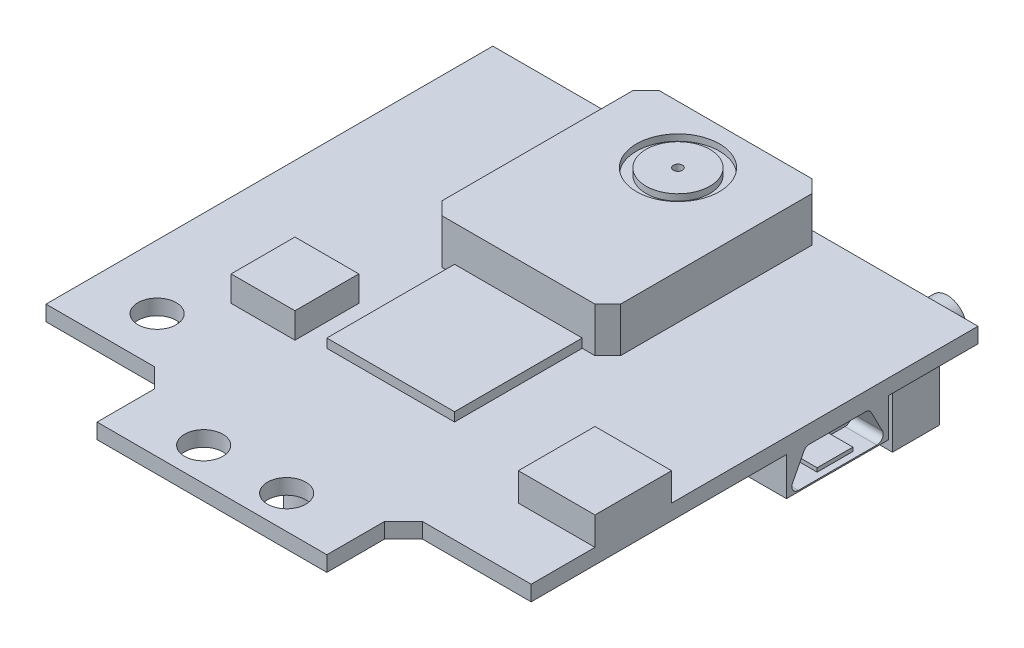
from build123d import *

# Parameters (mm, degrees)
SKETCH_1_R          = 1.5
EXTRUDE_1_DEPTH     = 1.2
EXTRUDE_2_DEPTH     = 3.5
SKETCH_3_R          = 3.25
SKETCH_3_R_2        = 2.5
CUT_EXTRUDE_1_DEPTH = 0.5
SKETCH_4_R          = 0.35
CUT_EXTRUDE_2_DEPTH = 0.7
SKETCH_5_W          = 6
SKETCH_5_H          = 6
EXTRUDE_3_DEPTH     = 2.2
SKETCH_6_W          = 10
SKETCH_6_H          = 10
EXTRUDE_4_DEPTH     = 0.7
SKETCH_7_W          = 5
SKETCH_7_H          = 5
EXTRUDE_5_DEPTH     = 2
SKETCH_8_W          = 5
SKETCH_8_H          = 8
EXTRUDE_6_DEPTH     = 3
CUT_EXTRUDE_3_DEPTH = 2.5
SKETCH_10_W         = 2.8
SKETCH_10_H         = 0.3
EXTRUDE_7_DEPTH     = 2.3
SKETCH_11_R         = 3
EXTRUDE_8_DEPTH     = 7.1
FILLET_1_R          = 0.02
SKETCH_12_W         = 7
SKETCH_12_H         = 3.7
EXTRUDE_9_DEPTH     = 7
SKETCH_13_R         = 1.5
EXTRUDE_10_DEPTH    = 4.1
SKETCH_14_W         = 8.5
SKETCH_14_H         = 20
SKETCH_14_W_2       = 7.5
SKETCH_14_H_2       = 19
EXTRUDE_11_DEPTH    = 9.5
SKETCH_15_W         = 0.5
SKETCH_15_H         = 0.5
EXTRUDE_12_DEPTH    = 8.5
SKETCH_16_W         = 0.5
SKETCH_16_H         = 0.5
EXTRUDE_13_DEPTH    = 8.5
SKETCH_17_W         = 7.5
SKETCH_17_H         = 19
EXTRUDE_14_DEPTH    = 2.5


with BuildPart() as part:
    # 草图1 → 凸台-拉伸1 (new body)
    with BuildSketch(Plane(origin=(0, 0, 0), x_dir=(1, 0, 0), z_dir=(0, 1, 0))):
        Polygon((9, -19), (10.5, -17.5), (19, -17.5), (19, 17.5), (-19, 17.5), (-19, -17.5), (-10.5, -17.5), (-9, -19), (-9, -23.5), (9, -23.5), align=None)
        with Locations((-14, -13.8)):
            Circle(SKETCH_1_R, mode=Mode.SUBTRACT)
        with Locations((-3.25, -20.9)):
            Circle(SKETCH_1_R, mode=Mode.SUBTRACT)
        with Locations((3.25, -20.9)):
            Circle(SKETCH_1_R, mode=Mode.SUBTRACT)
    extrude(amount=-EXTRUDE_1_DEPTH)

    # 草图2 → 凸台-拉伸2 (add)
    with BuildSketch(Plane(origin=(0, 0, 0), x_dir=(1, 0, 0), z_dir=(0, 1, 0))):
        Polygon((-6, 17.5), (6, 17.5), (7, 16.5), (7, 1.5), (6, 0.5), (-6, 0.5), (-7, 1.5), (-7, 16.5), align=None)
    extrude(amount=EXTRUDE_2_DEPTH)

    # 草图3 → 切除-拉伸1 (cut)
    with BuildSketch(Plane(origin=(0, 3.5, 0), x_dir=(1, 0, 0), z_dir=(0, 1, 0))):
        with Locations((0, 13)):
            Circle(SKETCH_3_R)
        with Locations((0, 13)):
            Circle(SKETCH_3_R_2, mode=Mode.SUBTRACT)
    extrude(amount=-CUT_EXTRUDE_1_DEPTH, mode=Mode.SUBTRACT)

    # 草图4 → 切除-拉伸2 (cut)
    with BuildSketch(Plane(origin=(0, 3.5, 0), x_dir=(1, 0, 0), z_dir=(0, 1, 0))):
        with Locations((0, 13)):
            Circle(SKETCH_4_R)
    extrude(amount=-CUT_EXTRUDE_2_DEPTH, mode=Mode.SUBTRACT)

    # 草图5 → 凸台-拉伸3 (add)
    with BuildSketch(Plane(origin=(0, 0, 0), x_dir=(1, 0, 0), z_dir=(0, 1, 0))):
        with Locations((16, -9.5)):
            Rectangle(SKETCH_5_W, SKETCH_5_H)
    extrude(amount=EXTRUDE_3_DEPTH)

    # 草图6 → 凸台-拉伸4 (add)
    with BuildSketch(Plane(origin=(0, 0, 0), x_dir=(1, 0, 0), z_dir=(0, 1, 0))):
        with Locations((0, -4.5)):
            Rectangle(SKETCH_6_W, SKETCH_6_H)
    extrude(amount=EXTRUDE_4_DEPTH)

    # 草图7 → 凸台-拉伸5 (add)
    with BuildSketch(Plane(origin=(0, 0, 0), x_dir=(1, 0, 0), z_dir=(0, 1, 0))):
        with Locations((-9.3, -7.7)):
            Rectangle(SKETCH_7_W, SKETCH_7_H)
    extrude(amount=EXTRUDE_5_DEPTH)

    # 草图8 → 凸台-拉伸6 (add)
    with BuildSketch(Plane.XZ.offset(1.2)):
        with Locations((16.5, -6.5)):
            Rectangle(SKETCH_8_W, SKETCH_8_H)
    extrude(amount=EXTRUDE_6_DEPTH)

    # 草图9 → 切除-拉伸3 (cut)
    with BuildSketch(Plane(origin=(19, 0, 0), x_dir=(0, 0, -1), z_dir=(1, 0, 0))):
        with BuildLine():
            Line((3.860082228, -1.669841418), (2.978600746, -3.369841418))
            ThreePointArc((2.978600746, -3.369841418), (2.995231426, -3.859731312), (3.422478012, -4.1))
            Line((3.422478012, -4.1), (9.577521988, -4.1))
            ThreePointArc((9.577521988, -4.1), (10.004768574, -3.859731312), (10.021399254, -3.369841418))
            Line((10.021399254, -3.369841418), (9.139917772, -1.669841418))
            ThreePointArc((9.139917772, -1.669841418), (8.955771818, -1.472753414), (8.696040506, -1.4))
            Line((8.696040506, -1.4), (4.303959494, -1.4))
            ThreePointArc((4.303959494, -1.4), (4.044228182, -1.472753414), (3.860082228, -1.669841418))
        make_face()
    extrude(amount=-CUT_EXTRUDE_3_DEPTH, mode=Mode.SUBTRACT)

    # 草图10 → 凸台-拉伸7 (add)
    with BuildSketch(Plane(origin=(16.5, 0, 0), x_dir=(0, 0, -1), z_dir=(1, 0, 0))):
        with Locations((6.5, -3.65)):
            Rectangle(SKETCH_10_W, SKETCH_10_H)
    extrude(amount=EXTRUDE_7_DEPTH)

    # 草图11 → 凸台-拉伸8 (add)
    with BuildSketch(Plane(origin=(0, -1.2, 0), x_dir=(-1, 0, 0), z_dir=(0, -1, 0))):
        with Locations((1.75, -11.9)):
            Circle(SKETCH_11_R)
    extrude(amount=EXTRUDE_8_DEPTH)

    # 圆角1
    fillet_1_edges = [part.edges().sort_by_distance(p)[0] for p in [
        (1.25, -8.3, 11.9),
    ]]
    fillet(fillet_1_edges, radius=FILLET_1_R)

    # 草图12 → 凸台-拉伸9 (add)
    with BuildSketch(Plane.XZ.offset(1.2)):
        with Locations((12.5, -15.65)):
            Rectangle(SKETCH_12_W, SKETCH_12_H)
    extrude(amount=EXTRUDE_9_DEPTH)

    # 草图13 → 凸台-拉伸10 (add)
    with BuildSketch(Plane(origin=(0, 0, -17.5), x_dir=(-1, 0, 0), z_dir=(0, 0, -1))):
        with Locations((-12.5, -4.7)):
            Circle(SKETCH_13_R)
    extrude(amount=EXTRUDE_10_DEPTH)

    # 草图14 → 凸台-拉伸11 (add)
    with BuildSketch(Plane.XZ.offset(1.2)):
        with Locations((-13.55, -7.45)):
            Rectangle(SKETCH_14_W, SKETCH_14_H)
        with Locations((-13.55, -7.45)):
            Rectangle(SKETCH_14_W_2, SKETCH_14_H_2, mode=Mode.SUBTRACT)
    extrude(amount=EXTRUDE_11_DEPTH)

    # 草图15 → 凸台-拉伸12 (add)
    with BuildSketch(Plane.XZ.offset(1.2)):
        with Locations((-14.55, -2.2)):
            Rectangle(SKETCH_15_W, SKETCH_15_H)
        with Locations((-12.05, -2.2)):
            Rectangle(SKETCH_15_W, SKETCH_15_H)
        with Locations((-12.05, -4.7)):
            Rectangle(SKETCH_15_W, SKETCH_15_H)
        with Locations((-12.05, -7.2)):
            Rectangle(SKETCH_15_W, SKETCH_15_H)
        with Locations((-12.05, -9.7)):
            Rectangle(SKETCH_15_W, SKETCH_15_H)
        with Locations((-12.05, -12.2)):
            Rectangle(SKETCH_15_W, SKETCH_15_H)
        with Locations((-14.55, -4.7)):
            Rectangle(SKETCH_15_W, SKETCH_15_H)
        with Locations((-14.55, -7.2)):
            Rectangle(SKETCH_15_W, SKETCH_15_H)
        with Locations((-14.55, -9.7)):
            Rectangle(SKETCH_15_W, SKETCH_15_H)
        with Locations((-14.55, -12.2)):
            Rectangle(SKETCH_15_W, SKETCH_15_H)
    extrude(amount=EXTRUDE_12_DEPTH)

    # 草图16 → 凸台-拉伸13 (add)
    with BuildSketch(Plane.XZ.offset(1.2)):
        with Locations((-14.55, 4.6)):
            Rectangle(SKETCH_16_W, SKETCH_16_H)
        with Locations((-12.05, 4.6)):
            Rectangle(SKETCH_16_W, SKETCH_16_H)
        with Locations((-12.05, 7.1)):
            Rectangle(SKETCH_16_W, SKETCH_16_H)
        with Locations((-12.05, 9.6)):
            Rectangle(SKETCH_16_W, SKETCH_16_H)
        with Locations((-14.55, 7.1)):
            Rectangle(SKETCH_16_W, SKETCH_16_H)
        with Locations((-14.55, 9.6)):
            Rectangle(SKETCH_16_W, SKETCH_16_H)
    extrude(amount=EXTRUDE_13_DEPTH)

    # 草图17 → 凸台-拉伸14 (add)
    with BuildSketch(Plane.XZ.offset(1.2)):
        with Locations((-13.55, -7.45)):
            Rectangle(SKETCH_17_W, SKETCH_17_H)
        with BuildLine():
            Line((-14.8, 10.85), (-11.8, 10.85))
            ThreePointArc((-11.8, 10.85), (-10.55, 9.6), (-11.8, 8.35))
            ThreePointArc((-11.8, 8.35), (-10.55, 7.1), (-11.8, 5.85))
            ThreePointArc((-11.8, 5.85), (-10.55, 4.6), (-11.8, 3.35))
            Line((-11.8, 3.35), (-14.8, 3.35))
            ThreePointArc((-14.8, 3.35), (-16.05, 4.6), (-14.8, 5.85))
            ThreePointArc((-14.8, 5.85), (-16.05, 7.1), (-14.8, 8.35))
            ThreePointArc((-14.8, 8.35), (-16.05, 9.6), (-14.8, 10.85))
        make_face()
    extrude(amount=EXTRUDE_14_DEPTH)


solid = part.part
